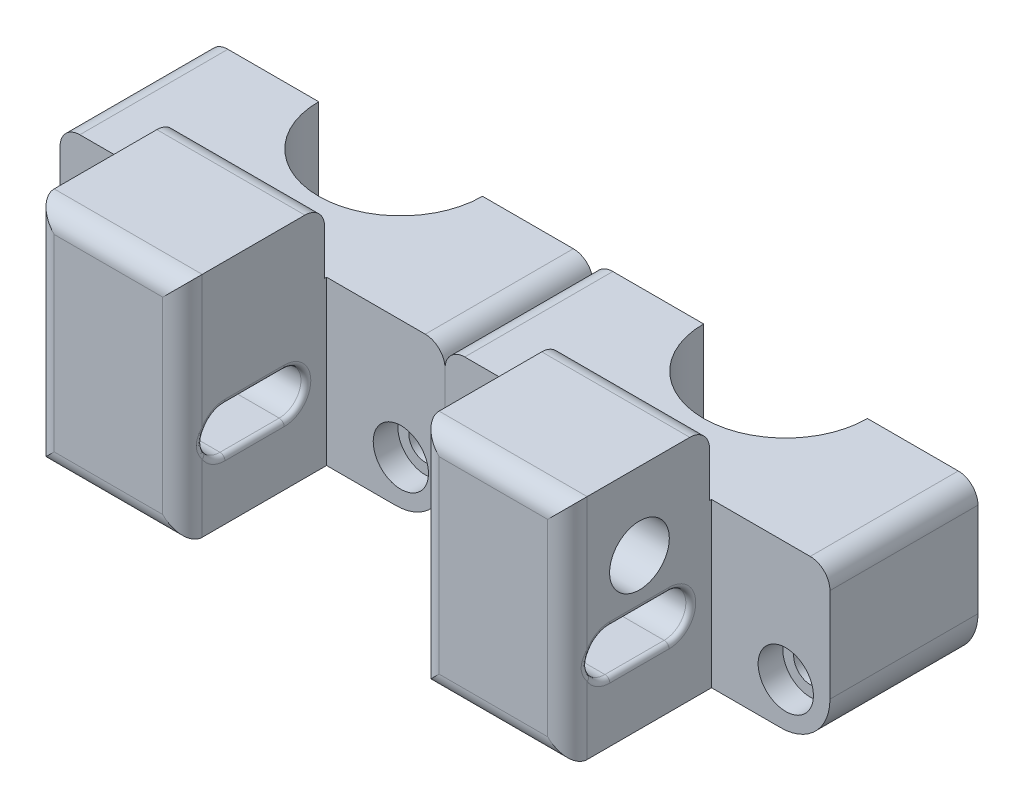
from build123d import *

# Parameters (mm, degrees)
SKETCH1_R           = 1.7
BOSS_EXTRUDE1_DEPTH = 15
SKETCH4_R           = 8.3
CUT_EXTRUDE1_DEPTH  = 16.52639628
SKETCH5_W           = 15
SKETCH5_H           = 16.52639628
BOSS_EXTRUDE2_DEPTH = 14.600589502
CUT_EXTRUDE2_DEPTH  = 15
SKETCH7_R           = 2.8
CUT_EXTRUDE3_DEPTH  = 2.5
SKETCH11_W          = 14.400589502
SKETCH11_H          = 11.726663515
SKETCH11_R          = 3.025
BOSS_EXTRUDE3_DEPTH = 15
CUT_EXTRUDE4_DEPTH  = 28
BOSS_EXTRUDE4_START = -15
SKETCH11_3_R        = 3.025
BOSS_EXTRUDE4_DEPTH = 8.7
FILLET1_R           = 2
FILLET2_R           = 0.5


with BuildPart() as part:
    # Sketch1 → Boss-Extrude1 (new body)
    with BuildSketch(Plane.XY):
        with BuildLine():
            Line((-17.328457201, -87.57905153), (-17.328457201, -76.05265525))
            Line((-17.328457201, -76.05265525), (21.671542799, -76.05265525))
            Line((21.671542799, -76.05265525), (21.671542799, -87.57905153))
            ThreePointArc((21.671542799, -87.57905153), (20.207076704, -91.114585436), (16.671542799, -92.57905153))
            Line((16.671542799, -92.57905153), (-12.328457201, -92.57905153))
            ThreePointArc((-12.328457201, -92.57905153), (-15.863991107, -91.114585436), (-17.328457201, -87.57905153))
        make_face()
        with Locations((-12.851746326, -88.102340655)):
            Circle(SKETCH1_R, mode=Mode.SUBTRACT)
        with Locations((17.194831923, -88.102340655)):
            Circle(SKETCH1_R, mode=Mode.SUBTRACT)
    extrude(amount=BOSS_EXTRUDE1_DEPTH)

    # Sketch4 → Cut-Extrude1 (cut)
    with BuildSketch(Plane.XZ.offset(92.57905153)):
        with Locations((2.171542799, 0)):
            Circle(SKETCH4_R)
    extrude(amount=-CUT_EXTRUDE1_DEPTH, mode=Mode.SUBTRACT)

    # Sketch5 → Boss-Extrude2 (add)
    with BuildSketch(Plane.XY.offset(15)):
        with Locations((2.171542799, -84.31585339)):
            Rectangle(SKETCH5_W, SKETCH5_H)
    extrude(amount=BOSS_EXTRUDE2_DEPTH)

    # Sketch6 → Cut-Extrude2 (cut)
    with BuildSketch(Plane.ZY.offset(5.328457201)):
        with BuildLine():
            Line((25.300294751, -86.51585339), (19.300294751, -86.51585339))
            ThreePointArc((19.300294751, -86.51585339), (17.100294751, -84.31585339), (19.300294751, -82.11585339))
            Line((19.300294751, -82.11585339), (25.300294751, -82.11585339))
            ThreePointArc((25.300294751, -82.11585339), (27.500294751, -84.31585339), (25.300294751, -86.51585339))
        make_face()
    extrude(amount=-CUT_EXTRUDE2_DEPTH, mode=Mode.SUBTRACT)

    # Sketch7 → Cut-Extrude3 (cut)
    with BuildSketch(Plane.XY.offset(15)):
        with Locations((17.194831923, -88.102340655)):
            Circle(SKETCH7_R)
        with Locations((-12.851746326, -88.102340655)):
            Circle(SKETCH7_R)
    extrude(amount=-CUT_EXTRUDE3_DEPTH, mode=Mode.SUBTRACT)

    # Sketch11 → Boss-Extrude3 (add)
    with BuildSketch(Plane(origin=(9.671542799, 0, 0), x_dir=(0, 0, -1), z_dir=(1, 0, 0))):
        with Locations((-22.400294751, -75.36667169)):
            Rectangle(SKETCH11_W, SKETCH11_H)
        with Locations((-22.300294751, -77.31585339)):
            Circle(SKETCH11_R, mode=Mode.SUBTRACT)
    extrude(amount=-BOSS_EXTRUDE3_DEPTH)

    # Sketch11<2> → Cut-Extrude4 (cut)
    with BuildSketch(Plane(origin=(9.671542799, 0, 0), x_dir=(0, 0, -1), z_dir=(1, 0, 0))):
        with BuildLine():
            Line((-25.048922674, -76.05265525), (-19.551666828, -76.05265525))
            ThreePointArc((-19.551666828, -76.05265525), (-22.300294751, -74.29085339), (-25.048922674, -76.05265525))
        make_face()
        with BuildLine():
            ThreePointArc((-19.275294751, -77.31585339), (-19.34519539, -76.669314322), (-19.551666828, -76.05265525))
            Line((-19.551666828, -76.05265525), (-25.048922674, -76.05265525))
            ThreePointArc((-25.048922674, -76.05265525), (-22.946833819, -80.270952751), (-19.275294751, -77.31585339))
        make_face()
    extrude(amount=-CUT_EXTRUDE4_DEPTH, mode=Mode.SUBTRACT)

    # Sketch11<3> → Boss-Extrude4 (add)
    with BuildSketch(Plane(origin=(9.671542799, 0, 0), x_dir=(0, 0, -1), z_dir=(1, 0, 0)).offset(BOSS_EXTRUDE4_START)):
        with Locations((-22.300294751, -77.31585339)):
            Circle(SKETCH11_3_R)
    extrude(amount=BOSS_EXTRUDE4_DEPTH)

    # Fillet1
    fillet1_edges = [part.edges().sort_by_distance(p)[0] for p in [
        (-17.328457201, -76.05265525, 7.5),
        (21.671542799, -76.05265525, 7.5),
        (2.171542799, -92.57905153, 29.600589502),
        (-5.328457201, -84.31585339, 29.600589502),
        (9.671542799, -84.31585339, 29.600589502),
        (2.171542799, -69.503339933, 15.2),
        (2.171542799, -69.503339933, 29.600589502),
    ]]
    fillet(fillet1_edges, radius=FILLET1_R)

    # Fillet2
    fillet2_edges = [part.edges().sort_by_distance(p)[0] for p in [
        (-5.328457201, -84.31585339, 27.500294751),
        (-5.328457201, -82.11585339, 22.300294751),
        (-5.328457201, -84.31585339, 17.100294751),
        (-5.328457201, -86.51585339, 22.300294751),
        (9.671542799, -84.31585339, 27.500294751),
        (9.671542799, -86.51585339, 22.300294751),
        (9.671542799, -84.31585339, 17.100294751),
        (9.671542799, -82.11585339, 22.300294751),
    ]]
    fillet(fillet2_edges, radius=FILLET2_R)


with BuildPart() as body_2:
    # Mirror1: mirrored copy
    add(part.part.mirror(Plane(origin=(-17.328457201, -87.57905153, 15), x_dir=(0, 0, 1), z_dir=(1, 0, 0))))


solid = Compound([part.part, body_2.part])
